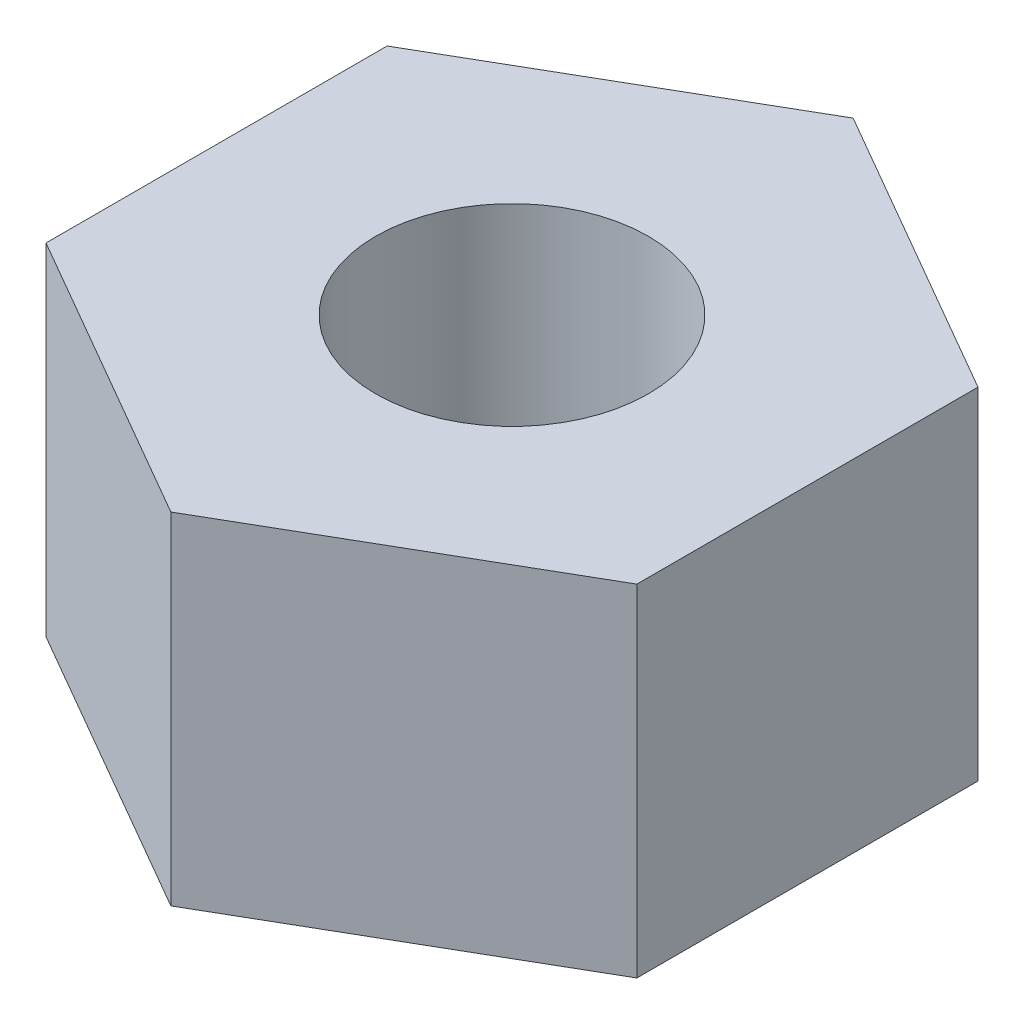
from build123d import *

# Parameters (mm, degrees)
SKETCH1_R           = 2
BOSS_EXTRUDE1_DEPTH = 5


with BuildPart() as part:
    # Sketch1 → Boss-Extrude1 (new body)
    with BuildSketch(Plane(origin=(0, 0, 0), x_dir=(1, 0, 0), z_dir=(0, 1, 0))):
        Polygon((4.330127019, -2.5), (4.330127019, 2.5), (0, 5), (-4.330127019, 2.5), (-4.330127019, -2.5), (0, -5), align=None)
        with Locations(Location((0, 0, 0), (0, 0, 270))):
            Circle(SKETCH1_R, mode=Mode.SUBTRACT)
    extrude(amount=BOSS_EXTRUDE1_DEPTH)


solid = part.part
